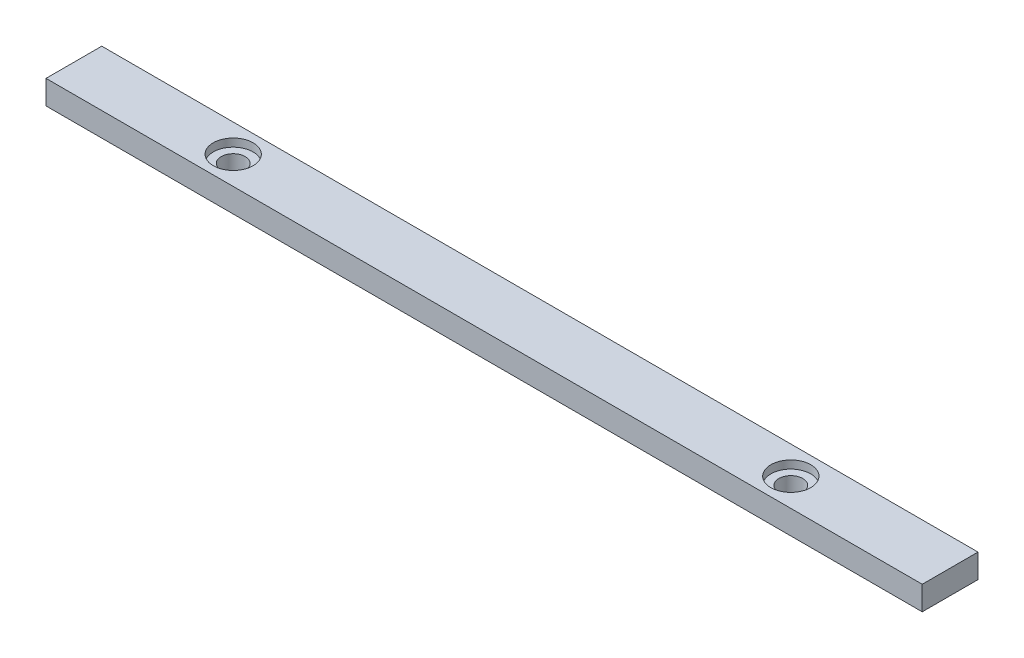
from build123d import *

# Parameters (mm, degrees)
SKETCH1_W           = 110
SKETCH1_H           = 7
SKETCH1_R           = 1.5
BOSS_EXTRUDE1_DEPTH = 3
SKETCH2_R           = 2.5
CUT_EXTRUDE1_DEPTH  = 1


with BuildPart() as part:
    # Sketch1 → Boss-Extrude1 (new body)
    with BuildSketch(Plane(origin=(0, 0, 0), x_dir=(1, 0, 0), z_dir=(0, 1, 0))):
        with Locations((55, 3.5)):
            Rectangle(SKETCH1_W, SKETCH1_H)
        with Locations(Location((20, 3.5, 0), (0, 0, 270))):
            Circle(SKETCH1_R, mode=Mode.SUBTRACT)
        with Locations(Location((90, 3.5, 0), (0, 0, 270))):
            Circle(SKETCH1_R, mode=Mode.SUBTRACT)
    extrude(amount=BOSS_EXTRUDE1_DEPTH)

    # Sketch2 → Cut-Extrude1 (cut)
    with BuildSketch(Plane(origin=(0, 3, 0), x_dir=(1, 0, 0), z_dir=(0, 1, 0))):
        with Locations(Location((20, 3.5, 0), (0, 0, 270))):
            Circle(SKETCH2_R)
        with Locations(Location((90, 3.5, 0), (0, 0, 270))):
            Circle(SKETCH2_R)
    extrude(amount=-CUT_EXTRUDE1_DEPTH, mode=Mode.SUBTRACT)


solid = part.part
